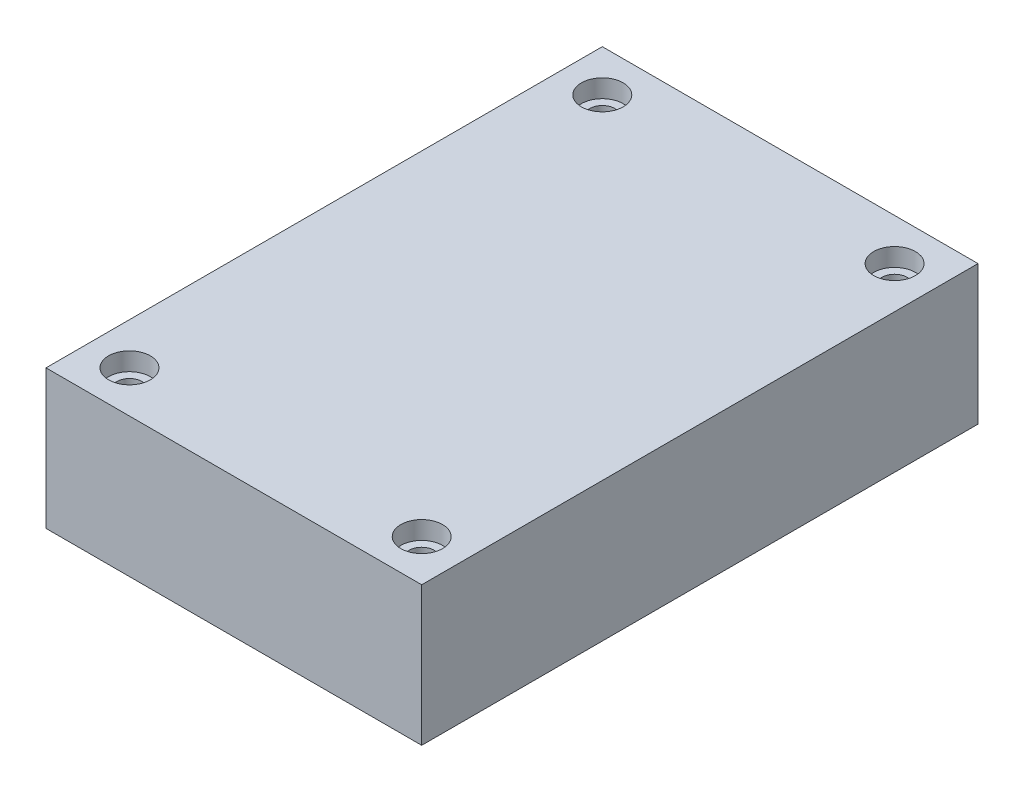
from build123d import *

# Parameters (mm, degrees)
SKIZZE1_W                                           = 135.069444444
SKIZZE1_H                                           = 50
AUFSATZ_LINEAR_AUSTRAGEN1_DEPTH                     = 200
STIRNSENKUNG_F_R_M8_SENKSCHRAUBE_KOPF_B_D           = 9
STIRNSENKUNG_F_R_M8_SENKSCHRAUBE_KOPF_B_CBORE_D     = 15
STIRNSENKUNG_F_R_M8_SENKSCHRAUBE_KOPF_B_CBORE_DEPTH = 6.5
SPIEGELN3_COPY_1_D                                  = 9
SPIEGELN3_COPY_1_CBORE_D                            = 15
SPIEGELN3_COPY_1_CBORE_DEPTH                        = 6.5


with BuildPart() as part:
    # Skizze1 → Aufsatz-Linear austragen1 (new body)
    with BuildSketch(Plane.XY):
        Rectangle(SKIZZE1_W, SKIZZE1_H)
    extrude(amount=AUFSATZ_LINEAR_AUSTRAGEN1_DEPTH)

    # Stirnsenkung für M8 Senkschraube (Kopf Button)4 (through all)
    with Locations(Plane(origin=(0, 25, 0), x_dir=(1, 0, 0), z_dir=(0, 1, 0))):
        with Locations((-52.534722222, -185)):
            stirnsenkung_f_r_m8_senkschraube_kopf_b = CounterBoreHole(STIRNSENKUNG_F_R_M8_SENKSCHRAUBE_KOPF_B_D / 2, STIRNSENKUNG_F_R_M8_SENKSCHRAUBE_KOPF_B_CBORE_D / 2, STIRNSENKUNG_F_R_M8_SENKSCHRAUBE_KOPF_B_CBORE_DEPTH)

    # Spiegeln2: Stirnsenkung für M8 Senkschraube (Kopf Button)4 across plane
    add(stirnsenkung_f_r_m8_senkschraube_kopf_b.mirror(Plane(origin=(0, 0, 0), x_dir=(0, 0, 1), z_dir=(1, 0, 0))), mode=Mode.SUBTRACT)

    # Spiegeln3: Stirnsenkung für M8 Senkschraube (Kopf Button)4 across plane
    add(stirnsenkung_f_r_m8_senkschraube_kopf_b.mirror(Plane.XY.offset(100)), mode=Mode.SUBTRACT)

    # Spiegeln3 copy 1 (through all)
    with Locations(Plane(origin=(0, 25, 200), x_dir=(-1, 0, 0), z_dir=(0, 1, 0))):
        with Locations((-52.534722222, -185)):
            CounterBoreHole(SPIEGELN3_COPY_1_D / 2, SPIEGELN3_COPY_1_CBORE_D / 2, SPIEGELN3_COPY_1_CBORE_DEPTH)


solid = part.part
